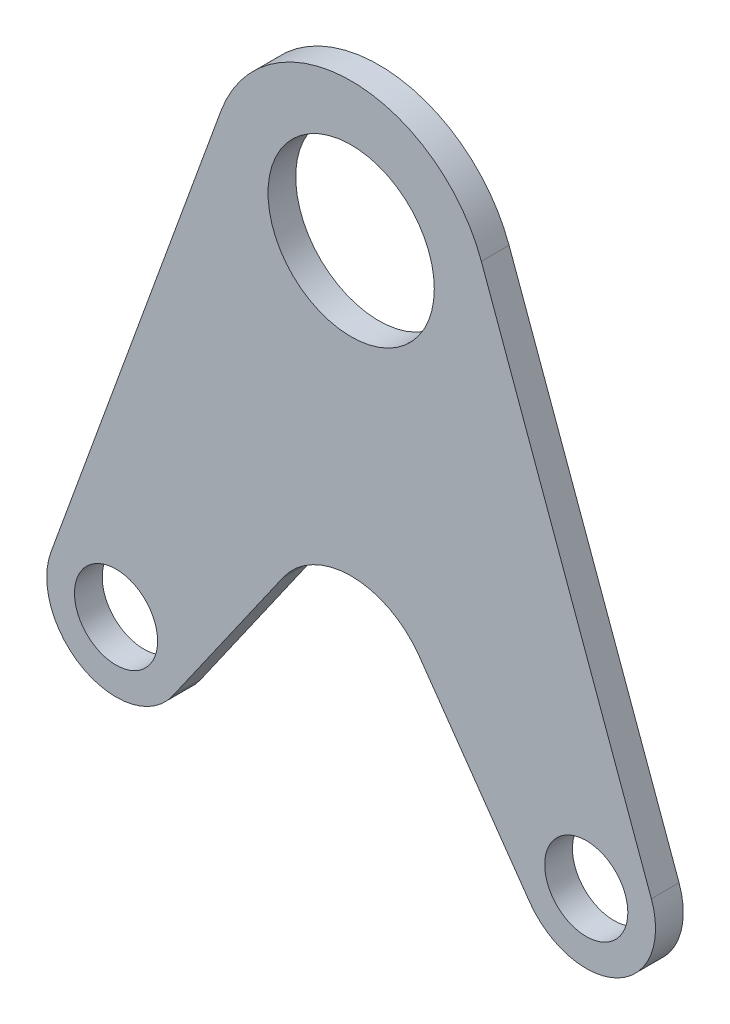
from build123d import *

# Parameters (mm, degrees)
SKETCH1_R           = 30
SKETCH1_R_2         = 15
BOSS_EXTRUDE1_DEPTH = 10


with BuildPart() as part:
    # Sketch1 → Boss-Extrude1 (new body)
    with BuildSketch(Plane.XY):
        with BuildLine():
            Line((-46.984631039, 17.101007166), (-108.331997314, -151.449496417))
            ThreePointArc((-108.331997314, -151.449496417), (-96.383397125, -182.175270829), (-64.360880687, -174.339410909))
            Line((-64.360880687, -174.339410909), (-24.574561329, -117.518658221))
            ThreePointArc((-24.574561329, -117.518658221), (0, -104.725951312), (24.574561329, -117.518658221))
            Line((24.574561329, -117.518658221), (64.360880687, -174.339410909))
            ThreePointArc((64.360880687, -174.339410909), (96.383397125, -182.175270829), (108.331997314, -151.449496417))
            Line((108.331997314, -151.449496417), (46.984631039, 17.101007166))
            ThreePointArc((46.984631039, 17.101007166), (0, 50), (-46.984631039, 17.101007166))
        make_face()
        Circle(SKETCH1_R, mode=Mode.SUBTRACT)
        with Locations((-84.839681794, -160)):
            Circle(SKETCH1_R_2, mode=Mode.SUBTRACT)
        with Locations((84.839681794, -160)):
            Circle(SKETCH1_R_2, mode=Mode.SUBTRACT)
    extrude(amount=BOSS_EXTRUDE1_DEPTH)


solid = part.part
